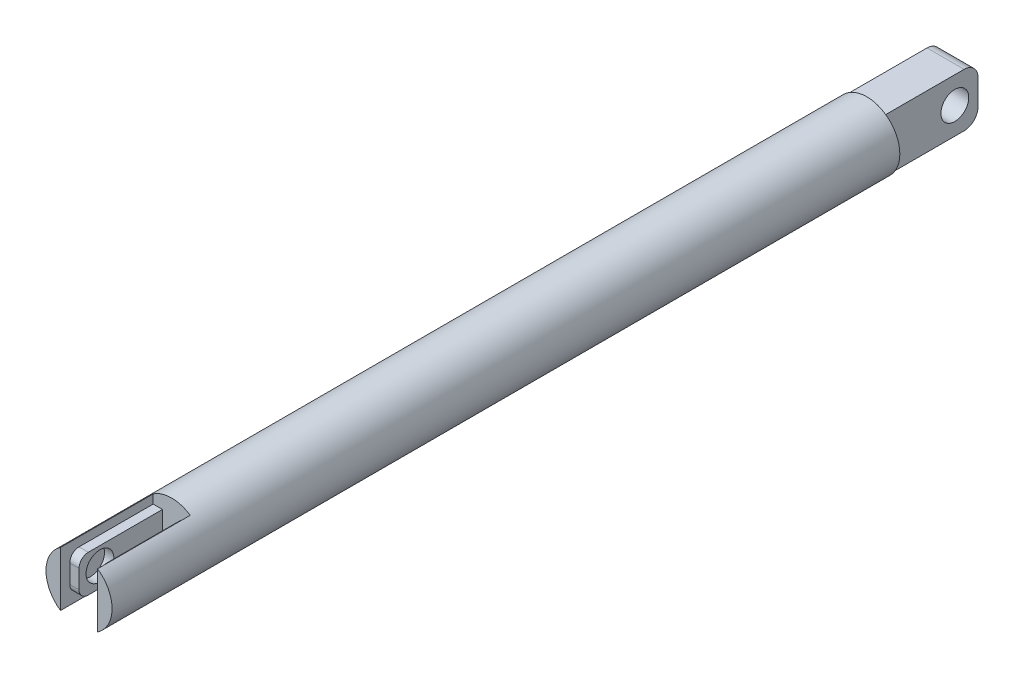
from build123d import *

# Parameters (mm, degrees)
SKETCH_1_W          = 2
SKETCH_1_H          = 8
EXTRUDE_2_DEPTH     = 8
EXTRUDE_2_2_DEPTH   = 8
SKETCH_1_3_R        = 7.129483457
EXTRUDE_3_DEPTH     = 150
SKETCH_2_W          = 2
SKETCH_2_H          = 8
EXTRUDE_4_DEPTH     = 10
FILLET_2_R          = 2
FILLET_3_R          = 2
FILLET_4_R          = 2
FILLET_5_R          = 2
SKETCH_3_R          = 3
CUT_EXTRUDE_1_DEPTH = 10
EXTRUDE_START       = 20
EXTRUDE_5_DEPTH     = 20
SKETCH_5_W          = 8
SKETCH_5_H          = 11.5
EXTRUDE_6_DEPTH     = 20
FILLET_6_R          = 3
FILLET_7_R          = 3
SKETCH_6_R          = 3
CUT_EXTRUDE_2_DEPTH = 20


with BuildPart() as part:
    # 草图1 → 凸台-拉伸2 (new body)
    with BuildSketch(Plane.XY):
        with Locations((-3, 0)):
            Rectangle(SKETCH_1_W, SKETCH_1_H)
    extrude(amount=EXTRUDE_2_DEPTH)



with BuildPart() as body_2:
    # 草图1 → Extrude 2 2 (new body)
    with BuildSketch(Plane.XY):
        with Locations((3, 0)):
            Rectangle(SKETCH_1_W, SKETCH_1_H)
    extrude(amount=EXTRUDE_2_2_DEPTH)


with BuildPart() as part_1:
    add(part.part)

    add(body_2.part)  # 凸台-拉伸3 merges body 2
    # 草图1<3> → 凸台-拉伸3 (add)
    with BuildSketch(Plane.XY):
        Circle(SKETCH_1_3_R)
    extrude(amount=-EXTRUDE_3_DEPTH)

    # 草图2 → 凸台-拉伸4 (add)
    with BuildSketch(Plane.XY.offset(8)):
        with Locations((3, 0)):
            Rectangle(SKETCH_2_W, SKETCH_2_H)
        with Locations((-3, 0)):
            Rectangle(SKETCH_2_W, SKETCH_2_H)
    extrude(amount=EXTRUDE_4_DEPTH)

    # 圆角2
    fillet_2_edges = [part_1.edges().sort_by_distance(p)[0] for p in [
        (-3, -4, 18),
    ]]
    fillet(fillet_2_edges, radius=FILLET_2_R)

    # 圆角3
    fillet_3_edges = [part_1.edges().sort_by_distance(p)[0] for p in [
        (3, -4, 18),
    ]]
    fillet(fillet_3_edges, radius=FILLET_3_R)

    # 圆角4
    fillet_4_edges = [part_1.edges().sort_by_distance(p)[0] for p in [
        (-3, 4, 18),
    ]]
    fillet(fillet_4_edges, radius=FILLET_4_R)

    # 圆角5
    fillet_5_edges = [part_1.edges().sort_by_distance(p)[0] for p in [
        (3, 4, 18),
    ]]
    fillet(fillet_5_edges, radius=FILLET_5_R)

    # 草图3 → 切除-拉伸1 (cut)
    with BuildSketch(Plane.ZY.offset(4)):
        with Locations((13.5, 0.200340445)):
            Circle(SKETCH_3_R)
    extrude(amount=-CUT_EXTRUDE_1_DEPTH, mode=Mode.SUBTRACT)

    # 草图4 → 凸台-拉伸5 (add)
    with BuildSketch(Plane.XY.offset(EXTRUDE_START)):
        with BuildLine():
            Line((-4, -5.901655223), (-4, 5.901655223))
            ThreePointArc((-4, 5.901655223), (-7.129483457, 0), (-4, -5.901655223))
        make_face()
        with BuildLine():
            ThreePointArc((4, -5.901655223), (7.129483457, 0), (4, 5.901655223))
            Line((4, 5.901655223), (4, -5.901655223))
        make_face()
    extrude(amount=-EXTRUDE_5_DEPTH)

    # 草图5 → 凸台-拉伸6 (add)
    with BuildSketch(Plane(origin=(0, 0, -150), x_dir=(-1, 0, 0), z_dir=(0, 0, -1))):
        Rectangle(SKETCH_5_W, SKETCH_5_H)
    extrude(amount=EXTRUDE_6_DEPTH)

    # 圆角6
    fillet_6_edges = [part_1.edges().sort_by_distance(p)[0] for p in [
        (0, -5.75, -170),
    ]]
    fillet(fillet_6_edges, radius=FILLET_6_R)

    # 圆角7
    fillet_7_edges = [part_1.edges().sort_by_distance(p)[0] for p in [
        (0, 5.75, -170),
    ]]
    fillet(fillet_7_edges, radius=FILLET_7_R)

    # 草图6 → 切除-拉伸2 (cut)
    with BuildSketch(Plane(origin=(4, 0, 0), x_dir=(0, 0, -1), z_dir=(1, 0, 0))):
        with Locations((165, 0)):
            Circle(SKETCH_6_R)
    extrude(amount=-CUT_EXTRUDE_2_DEPTH, mode=Mode.SUBTRACT)


solid = part_1.part
